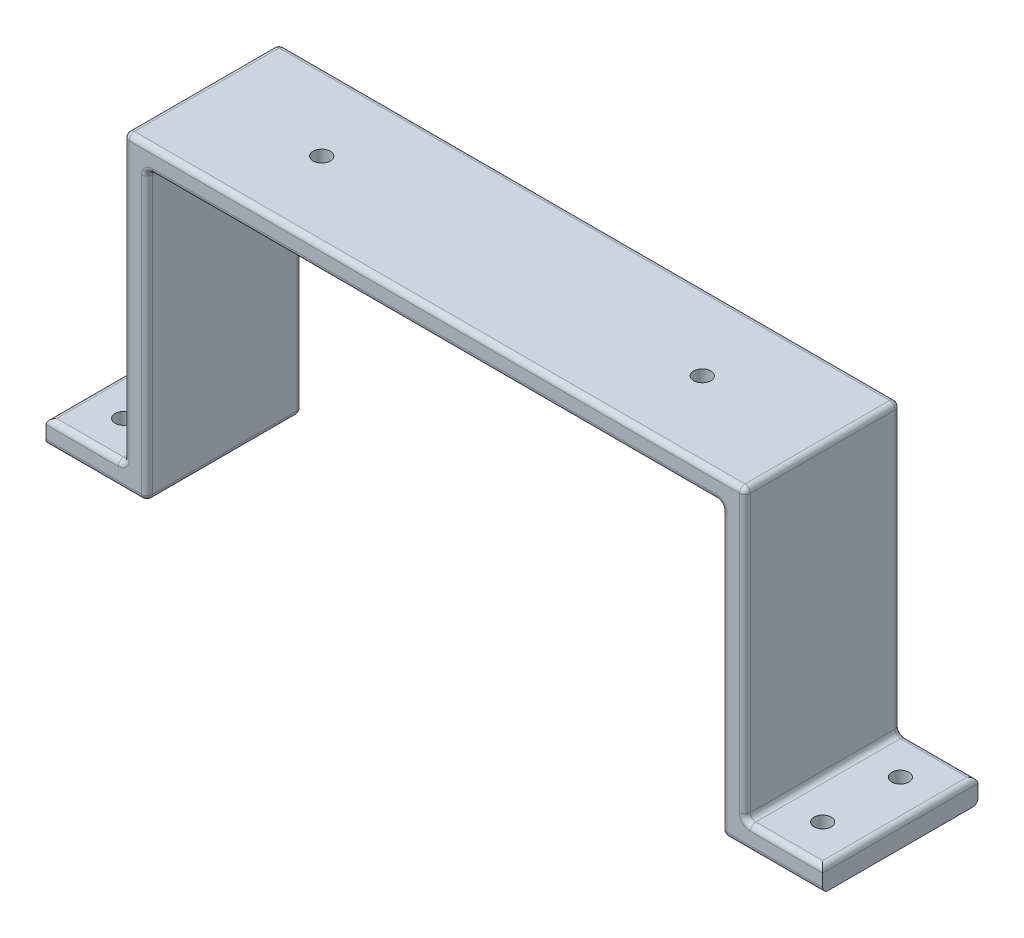
from build123d import *

# Parameters (mm, degrees)
SKETCH_1_W              = 10
SKETCH_1_H              = 20
EXTRUDE_1_DEPTH         = 3
HOLE_WIZARD_2_2_2_2_1_D = 2.2
SKETCH_5_W              = 20
SKETCH_5_H              = 40
EXTRUDE_2_DEPTH         = 80
CUT_EXTRUDE_1_REACH     = 107
SKETCH_6_W              = 74
SKETCH_6_H              = 37
HOLE_WIZARD_2_2_2_2_2_D = 2.2
FILLET_1_R              = 0.7


with BuildPart() as part:
    # 草图1 → 凸台-拉伸1 (new body)
    with BuildSketch(Plane(origin=(0, 0, 0), x_dir=(1, 0, 0), z_dir=(0, 1, 0))):
        Rectangle(SKETCH_1_W, SKETCH_1_H)
    extrude_1 = extrude(amount=EXTRUDE_1_DEPTH)

    # Ø2.2 (2.2) 直径孔1 (through all)
    with Locations(Plane(origin=(0, 3, 0), x_dir=(1, 0, 0), z_dir=(0, 1, 0))):
        with Locations((0, 5), (0, -5)):
            hole_wizard_2_2_2_2_1 = Hole(HOLE_WIZARD_2_2_2_2_1_D / 2)

    # 草图5 → 凸台-拉伸2 (add)
    with BuildSketch(Plane(origin=(5, 0, 0), x_dir=(0, 0, -1), z_dir=(1, 0, 0))):
        with Locations((0, 20)):
            Rectangle(SKETCH_5_W, SKETCH_5_H)
    extrude(amount=EXTRUDE_2_DEPTH)

    # 镜向1: 凸台-拉伸1, Ø2.2 (2.2) 直径孔1 across plane
    add(extrude_1.mirror(Plane.ZY.offset(-45)))
    add(hole_wizard_2_2_2_2_1.mirror(Plane.ZY.offset(-45)), mode=Mode.SUBTRACT)

    # 草图6 → 切除-拉伸1 (cut, up to next)
    with BuildSketch(Plane.XY.offset(10), mode=Mode.PRIVATE) as cut_extrude_1_sk1:
        with Locations((45, 18.5)):
            Rectangle(SKETCH_6_W, SKETCH_6_H)
    cut_extrude_1_tool1 = extrude(cut_extrude_1_sk1.sketch, amount=-CUT_EXTRUDE_1_REACH, mode=Mode.PRIVATE) & part.part
    add(cut_extrude_1_tool1.solids().sort_by_distance((45, 18.5, 10))[0], mode=Mode.SUBTRACT)

    # Ø2.2 (2.2) 直径孔2 (through all)
    with Locations(Plane(origin=(0, 40, 0), x_dir=(1, 0, 0), z_dir=(0, 1, 0))):
        with Locations((20.5, 0), (69.5, 0)):
            Hole(HOLE_WIZARD_2_2_2_2_2_D / 2)

    # 圆角1
    fillet_1_edges = [part.edges().sort_by_distance(p)[0] for p in [
        (5, 3, 0),
        (0, 3, -10),
        (5, 21.5, 10),
        (45, 40, 10),
        (5, 21.5, -10),
        (5, 40, 0),
        (45, 40, -10),
        (85, 21.5, 10),
        (85, 40, 0),
        (85, 21.5, -10),
        (95, 3, 0),
        (90, 3, -10),
        (85, 3, 0),
        (90, 3, 10),
        (-5, 3, 0),
        (88.5, 0, -10),
        (1.5, 0, 10),
        (1.5, 0, -10),
        (88.5, 0, 10),
        (8, 0, 0),
        (8, 37, 0),
        (82, 37, 0),
        (82, 0, 0),
        (8, 18.5, 10),
        (82, 18.5, 10),
        (45, 37, 10),
        (8, 18.5, -10),
        (45, 37, -10),
        (82, 18.5, -10),
        (0, 3, 10),
    ]]
    fillet(fillet_1_edges, radius=FILLET_1_R)


solid = part.part
